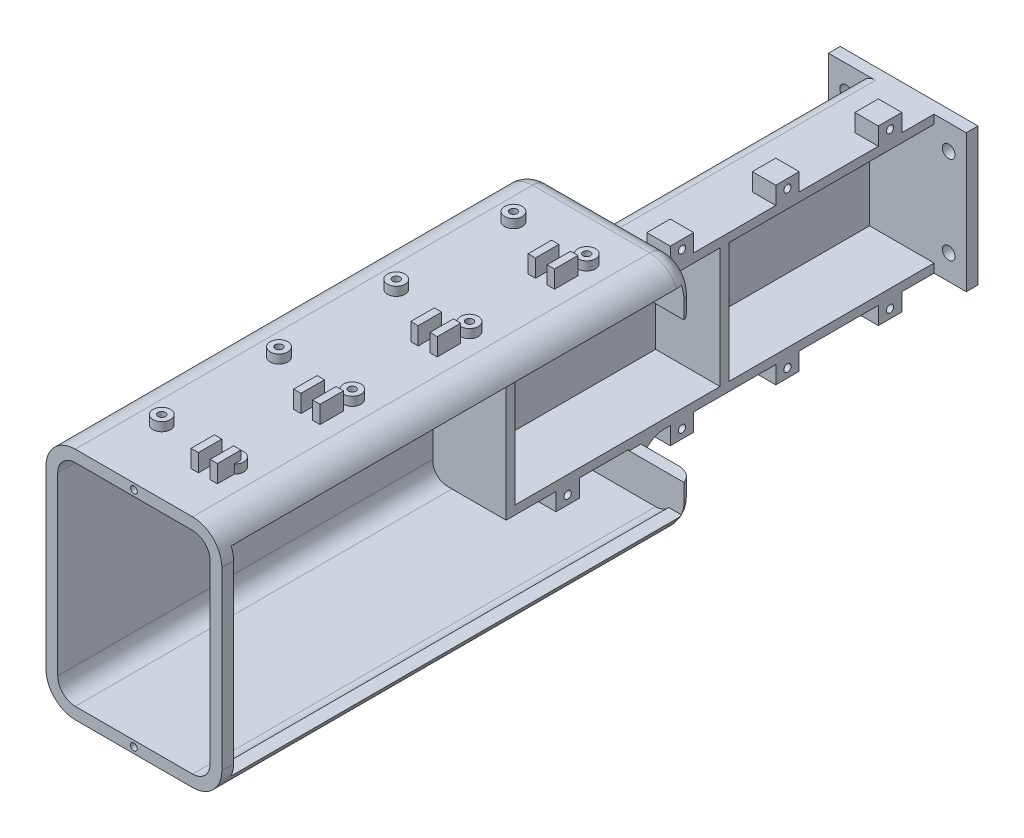
from build123d import *

# Parameters (mm, degrees)
EXTRUDE_1_DEPTH     = 150
FILLET_1_R          = 5
SKETCH_2_W          = 47
SKETCH_2_H          = 47
SKETCH_2_R          = 2.15
EXTRUDE_2_DEPTH     = 4
EXTRUDE_START       = 74
SKETCH_3_W          = 22.5
SKETCH_3_H          = 42
EXTRUDE_3_DEPTH     = 3
EXTRUDE_START_2     = 147
SKETCH_4_W          = 22.5
SKETCH_4_H          = 42
EXTRUDE_4_DEPTH     = 3
EXTRUDE_START_3     = 104
EXTRUDE_5_DEPTH     = 4
EXTRUDE_START_4     = 108
EXTRUDE_6_DEPTH     = 158
FILLET_2_R          = 8
FILLET_3_R          = 6
CUT_EXTRUDE_START   = 77
SKETCH_7_W          = 46
SKETCH_7_H          = 41
CUT_EXTRUDE_1_DEPTH = 70
CUT_EXTRUDE_START_2 = 103
SKETCH_8_W          = 24
SKETCH_8_H          = 48
CUT_EXTRUDE_2_DEPTH = 5.5
CUT_EXTRUDE_START_3 = 108
SKETCH_9_W          = 11
SKETCH_9_H          = 68
CUT_EXTRUDE_3_DEPTH = 154
CUT_EXTRUDE_START_4 = 258
SKETCH_10_R         = 1.15
CUT_EXTRUDE_4_DEPTH = 8
EXTRUDE_START_5     = 40
SKETCH_11_R         = 3
SKETCH_11_R_2       = 1.25
EXTRUDE_7_DEPTH     = 3
EXTRUDE_START_6     = -43
SKETCH_12_R         = 3
SKETCH_12_R_2       = 1.25
EXTRUDE_8_DEPTH     = 3
EXTRUDE_START_7     = -30
SKETCH_13_R         = 3
SKETCH_13_R_2       = 1.25
EXTRUDE_9_DEPTH     = 3
EXTRUDE_START_8     = 3
SKETCH_14_W         = 8
SKETCH_14_H         = 6.5
SKETCH_14_R         = 1.25
EXTRUDE_10_DEPTH    = 8
SKETCH_15_W         = 2.5
SKETCH_15_H         = 8
EXTRUDE_11_DEPTH    = 6
EXTRUDE_START_9     = -40
SKETCH_16_W         = 2.5
SKETCH_16_H         = 8
EXTRUDE_12_DEPTH    = 6


with BuildPart() as part:
    # 草圖1 → 填料-伸長1 (new body)
    with BuildSketch(Plane.XY):
        Polygon((-14, -23.5), (11, -23.5), (11, -20.5), (-11, -20.5), (-11, 20.5), (11, 20.5), (11, 23.5), (-14, 23.5), align=None)
    extrude(amount=EXTRUDE_1_DEPTH)

    # 圓角1
    fillet_1_edges = [part.edges().sort_by_distance(p)[0] for p in [
        (-14, 23.5, 75),
        (-14, -23.5, 75),
    ]]
    fillet(fillet_1_edges, radius=FILLET_1_R)

    # 草圖2 → 填料-伸長2 (add)
    with BuildSketch(Plane.XY):
        with Locations((-1.5, 0)):
            Rectangle(SKETCH_2_W, SKETCH_2_H)
        with Locations((-19, 15)):
            Circle(SKETCH_2_R, mode=Mode.SUBTRACT)
        with Locations((-19, -15)):
            Circle(SKETCH_2_R, mode=Mode.SUBTRACT)
        with Locations((16, 15)):
            Circle(SKETCH_2_R, mode=Mode.SUBTRACT)
        with Locations((16, -15)):
            Circle(SKETCH_2_R, mode=Mode.SUBTRACT)
    extrude(amount=EXTRUDE_2_DEPTH)

    # 草圖3 → 填料-伸長3 (add)
    with BuildSketch(Plane.XY.offset(EXTRUDE_START)):
        with Locations((-0.25, 0)):
            Rectangle(SKETCH_3_W, SKETCH_3_H)
    extrude(amount=EXTRUDE_3_DEPTH)

    # 草圖4 → 填料-伸長4 (add)
    with BuildSketch(Plane.XY.offset(EXTRUDE_START_2)):
        with Locations((-0.25, 0)):
            Rectangle(SKETCH_4_W, SKETCH_4_H)
    extrude(amount=EXTRUDE_4_DEPTH)

    # 草圖5 → 填料-伸長5 (add)
    with BuildSketch(Plane.XY.offset(EXTRUDE_START_3)):
        with BuildLine():
            Line((30, -30), (30, 30))
            ThreePointArc((30, 30), (27.071067812, 37.071067812), (20, 40))
            Line((20, 40), (-20, 40))
            ThreePointArc((-20, 40), (-27.071067812, 37.071067812), (-30, 30))
            Line((-30, 30), (-30, -30))
            ThreePointArc((-30, -30), (-27.071067812, -37.071067812), (-20, -40))
            Line((-20, -40), (20, -40))
            ThreePointArc((20, -40), (27.071067812, -37.071067812), (30, -30))
        make_face()
    extrude(amount=EXTRUDE_5_DEPTH)

    # 草圖6 → 填料-伸長6 (add)
    with BuildSketch(Plane.XY.offset(EXTRUDE_START_4)):
        with BuildLine():
            Line((30, -30), (30, 30))
            ThreePointArc((30, 30), (27.071067812, 37.071067812), (20, 40))
            Line((20, 40), (-20, 40))
            ThreePointArc((-20, 40), (-27.071067812, 37.071067812), (-30, 30))
            Line((-30, 30), (-30, -30))
            ThreePointArc((-30, -30), (-27.071067812, -37.071067812), (-20, -40))
            Line((-20, -40), (20, -40))
            ThreePointArc((20, -40), (27.071067812, -37.071067812), (30, -30))
        make_face()
        with BuildLine():
            Line((26, -30), (26, 30))
            ThreePointArc((26, 30), (24.242640687, 34.242640687), (20, 36))
            Line((20, 36), (-20, 36))
            ThreePointArc((-20, 36), (-24.242640687, 34.242640687), (-26, 30))
            Line((-26, 30), (-26, -30))
            ThreePointArc((-26, -30), (-24.242640687, -34.242640687), (-20, -36))
            Line((-20, -36), (20, -36))
            ThreePointArc((20, -36), (24.242640687, -34.242640687), (26, -30))
        make_face(mode=Mode.SUBTRACT)
    extrude(amount=EXTRUDE_6_DEPTH)

    # 圓角2
    fillet_2_edges = [part.edges().sort_by_distance(p)[0] for p in [
        (-12.535533906, -22.035533906, 104),
        (1, 23.5, 104),
        (-14, 0, 104),
        (1, -23.5, 104),
        (-12.535533906, 22.035533906, 104),
    ]]
    fillet(fillet_2_edges, radius=FILLET_2_R)

    # 圓角3
    fillet_3_edges = [part.edges().sort_by_distance(p)[0] for p in [
        (27.071067812, -37.071067812, 104),
        (30, 0, 104),
        (27.071067812, 37.071067812, 104),
        (0, 40, 104),
        (-27.071067812, 37.071067812, 104),
        (-30, 0, 104),
        (-27.071067812, -37.071067812, 104),
        (0, -40, 104),
    ]]
    fillet(fillet_3_edges, radius=FILLET_3_R)

    # 草圖7 → 除料-伸長1 (cut)
    with BuildSketch(Plane.XY.offset(CUT_EXTRUDE_START)):
        with Locations((12, 0)):
            Rectangle(SKETCH_7_W, SKETCH_7_H)
    extrude(amount=CUT_EXTRUDE_1_DEPTH, mode=Mode.SUBTRACT)

    # 草圖8 → 除料-伸長2 (cut)
    with BuildSketch(Plane.XY.offset(CUT_EXTRUDE_START_2)):
        with Locations((23, 0)):
            Rectangle(SKETCH_8_W, SKETCH_8_H)
    extrude(amount=CUT_EXTRUDE_2_DEPTH, mode=Mode.SUBTRACT)

    # 草圖9 → 除料-伸長3 (cut)
    with BuildSketch(Plane.XY.offset(CUT_EXTRUDE_START_3)):
        with Locations((29.5, 0)):
            Rectangle(SKETCH_9_W, SKETCH_9_H)
    extrude(amount=CUT_EXTRUDE_3_DEPTH, mode=Mode.SUBTRACT)

    # 草圖10 → 除料-伸長4 (cut)
    with BuildSketch(Plane.XY.offset(CUT_EXTRUDE_START_4)):
        with Locations((0, 38)):
            Circle(SKETCH_10_R)
        with Locations((0, -38)):
            Circle(SKETCH_10_R)
    extrude(amount=CUT_EXTRUDE_4_DEPTH, mode=Mode.SUBTRACT)

    # 草圖11 → 填料-伸長7 (add)
    # profile 1 of 8: a face of its own
    with BuildSketch(Plane(origin=(0, 0, 0), x_dir=(1, 0, 0), z_dir=(0, 1, 0)).offset(EXTRUDE_START_5)):
        with Locations(Location((-12.5, -124, 0), (0, 0, 90))):
            Circle(SKETCH_11_R)
        with Locations(Location((-12.5, -124, 0), (0, 0, 270))):
            Circle(SKETCH_11_R_2, mode=Mode.SUBTRACT)
    # profile 2 of 8: a face of its own
    with BuildSketch(Plane(origin=(0, 0, 0), x_dir=(1, 0, 0), z_dir=(0, 1, 0)).offset(EXTRUDE_START_5)):
        with Locations(Location((-12.5, -164, 0), (0, 0, 90))):
            Circle(SKETCH_11_R)
        with Locations(Location((-12.5, -164, 0), (0, 0, 270))):
            Circle(SKETCH_11_R_2, mode=Mode.SUBTRACT)
    # profile 3 of 8: a face of its own
    with BuildSketch(Plane(origin=(0, 0, 0), x_dir=(1, 0, 0), z_dir=(0, 1, 0)).offset(EXTRUDE_START_5)):
        with Locations(Location((-12.5, -204, 0), (0, 0, 90))):
            Circle(SKETCH_11_R)
        with Locations(Location((-12.5, -204, 0), (0, 0, 270))):
            Circle(SKETCH_11_R_2, mode=Mode.SUBTRACT)
    # profile 4 of 8: a face of its own
    with BuildSketch(Plane(origin=(0, 0, 0), x_dir=(1, 0, 0), z_dir=(0, 1, 0)).offset(EXTRUDE_START_5)):
        with Locations(Location((-12.5, -244, 0), (0, 0, 90))):
            Circle(SKETCH_11_R)
        with Locations(Location((-12.5, -244, 0), (0, 0, 270))):
            Circle(SKETCH_11_R_2, mode=Mode.SUBTRACT)
    # profile 5 of 8: a face of its own
    with BuildSketch(Plane(origin=(0, 0, 0), x_dir=(1, 0, 0), z_dir=(0, 1, 0)).offset(EXTRUDE_START_5)):
        with Locations(Location((12.5, -124, 0), (0, 0, 90))):
            Circle(SKETCH_11_R)
        with Locations(Location((12.5, -124, 0), (0, 0, 270))):
            Circle(SKETCH_11_R_2, mode=Mode.SUBTRACT)
    # profile 6 of 8: a face of its own
    with BuildSketch(Plane(origin=(0, 0, 0), x_dir=(1, 0, 0), z_dir=(0, 1, 0)).offset(EXTRUDE_START_5)):
        with Locations(Location((12.5, -164, 0), (0, 0, 90))):
            Circle(SKETCH_11_R)
        with Locations(Location((12.5, -164, 0), (0, 0, 270))):
            Circle(SKETCH_11_R_2, mode=Mode.SUBTRACT)
    # profile 7 of 8: a face of its own
    with BuildSketch(Plane(origin=(0, 0, 0), x_dir=(1, 0, 0), z_dir=(0, 1, 0)).offset(EXTRUDE_START_5)):
        with Locations(Location((12.5, -204, 0), (0, 0, 90))):
            Circle(SKETCH_11_R)
        with Locations(Location((12.5, -204, 0), (0, 0, 270))):
            Circle(SKETCH_11_R_2, mode=Mode.SUBTRACT)
    # profile 8 of 8: a face of its own
    with BuildSketch(Plane(origin=(0, 0, 0), x_dir=(1, 0, 0), z_dir=(0, 1, 0)).offset(EXTRUDE_START_5)):
        with Locations(Location((12.5, -244, 0), (0, 0, 90))):
            Circle(SKETCH_11_R)
        with Locations(Location((12.5, -244, 0), (0, 0, 270))):
            Circle(SKETCH_11_R_2, mode=Mode.SUBTRACT)
    extrude(amount=EXTRUDE_7_DEPTH)

    # 草圖12 → 填料-伸長8 (add)
    # profile 1 of 8: a face of its own
    with BuildSketch(Plane(origin=(0, 0, 0), x_dir=(1, 0, 0), z_dir=(0, 1, 0)).offset(EXTRUDE_START_6)):
        with Locations(Location((-12.5, -124, 0), (0, 0, 90))):
            Circle(SKETCH_12_R)
        with Locations(Location((-12.5, -124, 0), (0, 0, 270))):
            Circle(SKETCH_12_R_2, mode=Mode.SUBTRACT)
    # profile 2 of 8: a face of its own
    with BuildSketch(Plane(origin=(0, 0, 0), x_dir=(1, 0, 0), z_dir=(0, 1, 0)).offset(EXTRUDE_START_6)):
        with Locations(Location((-12.5, -164, 0), (0, 0, 90))):
            Circle(SKETCH_12_R)
        with Locations(Location((-12.5, -164, 0), (0, 0, 270))):
            Circle(SKETCH_12_R_2, mode=Mode.SUBTRACT)
    # profile 3 of 8: a face of its own
    with BuildSketch(Plane(origin=(0, 0, 0), x_dir=(1, 0, 0), z_dir=(0, 1, 0)).offset(EXTRUDE_START_6)):
        with Locations(Location((-12.5, -204, 0), (0, 0, 90))):
            Circle(SKETCH_12_R)
        with Locations(Location((-12.5, -204, 0), (0, 0, 270))):
            Circle(SKETCH_12_R_2, mode=Mode.SUBTRACT)
    # profile 4 of 8: a face of its own
    with BuildSketch(Plane(origin=(0, 0, 0), x_dir=(1, 0, 0), z_dir=(0, 1, 0)).offset(EXTRUDE_START_6)):
        with Locations(Location((-12.5, -244, 0), (0, 0, 90))):
            Circle(SKETCH_12_R)
        with Locations(Location((-12.5, -244, 0), (0, 0, 270))):
            Circle(SKETCH_12_R_2, mode=Mode.SUBTRACT)
    # profile 5 of 8: a face of its own
    with BuildSketch(Plane(origin=(0, 0, 0), x_dir=(1, 0, 0), z_dir=(0, 1, 0)).offset(EXTRUDE_START_6)):
        with Locations(Location((12.5, -124, 0), (0, 0, 90))):
            Circle(SKETCH_12_R)
        with Locations(Location((12.5, -124, 0), (0, 0, 270))):
            Circle(SKETCH_12_R_2, mode=Mode.SUBTRACT)
    # profile 6 of 8: a face of its own
    with BuildSketch(Plane(origin=(0, 0, 0), x_dir=(1, 0, 0), z_dir=(0, 1, 0)).offset(EXTRUDE_START_6)):
        with Locations(Location((12.5, -164, 0), (0, 0, 90))):
            Circle(SKETCH_12_R)
        with Locations(Location((12.5, -164, 0), (0, 0, 270))):
            Circle(SKETCH_12_R_2, mode=Mode.SUBTRACT)
    # profile 7 of 8: a face of its own
    with BuildSketch(Plane(origin=(0, 0, 0), x_dir=(1, 0, 0), z_dir=(0, 1, 0)).offset(EXTRUDE_START_6)):
        with Locations(Location((12.5, -204, 0), (0, 0, 90))):
            Circle(SKETCH_12_R)
        with Locations(Location((12.5, -204, 0), (0, 0, 270))):
            Circle(SKETCH_12_R_2, mode=Mode.SUBTRACT)
    # profile 8 of 8: a face of its own
    with BuildSketch(Plane(origin=(0, 0, 0), x_dir=(1, 0, 0), z_dir=(0, 1, 0)).offset(EXTRUDE_START_6)):
        with Locations(Location((12.5, -244, 0), (0, 0, 90))):
            Circle(SKETCH_12_R)
        with Locations(Location((12.5, -244, 0), (0, 0, 270))):
            Circle(SKETCH_12_R_2, mode=Mode.SUBTRACT)
    extrude(amount=EXTRUDE_8_DEPTH)

    # 草圖13 → 填料-伸長9 (add)
    # profile 1 of 8: a face of its own
    with BuildSketch(Plane(origin=(0, 0, 0), x_dir=(0, 0, -1), z_dir=(1, 0, 0)).offset(EXTRUDE_START_7)):
        with Locations((-124, -15)):
            Circle(SKETCH_13_R)
        with Locations((-124, -15)):
            Circle(SKETCH_13_R_2, mode=Mode.SUBTRACT)
    # profile 2 of 8: a face of its own
    with BuildSketch(Plane(origin=(0, 0, 0), x_dir=(0, 0, -1), z_dir=(1, 0, 0)).offset(EXTRUDE_START_7)):
        with Locations((-164, -15)):
            Circle(SKETCH_13_R)
        with Locations((-164, -15)):
            Circle(SKETCH_13_R_2, mode=Mode.SUBTRACT)
    # profile 3 of 8: a face of its own
    with BuildSketch(Plane(origin=(0, 0, 0), x_dir=(0, 0, -1), z_dir=(1, 0, 0)).offset(EXTRUDE_START_7)):
        with Locations((-204, -15)):
            Circle(SKETCH_13_R)
        with Locations((-204, -15)):
            Circle(SKETCH_13_R_2, mode=Mode.SUBTRACT)
    # profile 4 of 8: a face of its own
    with BuildSketch(Plane(origin=(0, 0, 0), x_dir=(0, 0, -1), z_dir=(1, 0, 0)).offset(EXTRUDE_START_7)):
        with Locations((-244, -15)):
            Circle(SKETCH_13_R)
        with Locations((-244, -15)):
            Circle(SKETCH_13_R_2, mode=Mode.SUBTRACT)
    # profile 5 of 8: a face of its own
    with BuildSketch(Plane(origin=(0, 0, 0), x_dir=(0, 0, -1), z_dir=(1, 0, 0)).offset(EXTRUDE_START_7)):
        with Locations((-124, 15)):
            Circle(SKETCH_13_R)
        with Locations((-124, 15)):
            Circle(SKETCH_13_R_2, mode=Mode.SUBTRACT)
    # profile 6 of 8: a face of its own
    with BuildSketch(Plane(origin=(0, 0, 0), x_dir=(0, 0, -1), z_dir=(1, 0, 0)).offset(EXTRUDE_START_7)):
        with Locations((-164, 15)):
            Circle(SKETCH_13_R)
        with Locations((-164, 15)):
            Circle(SKETCH_13_R_2, mode=Mode.SUBTRACT)
    # profile 7 of 8: a face of its own
    with BuildSketch(Plane(origin=(0, 0, 0), x_dir=(0, 0, -1), z_dir=(1, 0, 0)).offset(EXTRUDE_START_7)):
        with Locations((-204, 15)):
            Circle(SKETCH_13_R)
        with Locations((-204, 15)):
            Circle(SKETCH_13_R_2, mode=Mode.SUBTRACT)
    # profile 8 of 8: a face of its own
    with BuildSketch(Plane(origin=(0, 0, 0), x_dir=(0, 0, -1), z_dir=(1, 0, 0)).offset(EXTRUDE_START_7)):
        with Locations((-244, 15)):
            Circle(SKETCH_13_R)
        with Locations((-244, 15)):
            Circle(SKETCH_13_R_2, mode=Mode.SUBTRACT)
    extrude(amount=-EXTRUDE_9_DEPTH)

    # 草圖14 → 填料-伸長10 (add)
    # profile 1 of 8: a face of its own
    with BuildSketch(Plane(origin=(0, 0, 0), x_dir=(0, 0, -1), z_dir=(1, 0, 0)).offset(EXTRUDE_START_8)):
        with Locations((-19, 26.25)):
            Rectangle(SKETCH_14_W, SKETCH_14_H)
        with Locations((-19, 26.5)):
            Circle(SKETCH_14_R, mode=Mode.SUBTRACT)
    # profile 2 of 8: a face of its own
    with BuildSketch(Plane(origin=(0, 0, 0), x_dir=(0, 0, -1), z_dir=(1, 0, 0)).offset(EXTRUDE_START_8)):
        with Locations((-19, -26.25)):
            Rectangle(SKETCH_14_W, SKETCH_14_H)
        with Locations((-19, -26.5)):
            Circle(SKETCH_14_R, mode=Mode.SUBTRACT)
    # profile 3 of 8: a face of its own
    with BuildSketch(Plane(origin=(0, 0, 0), x_dir=(0, 0, -1), z_dir=(1, 0, 0)).offset(EXTRUDE_START_8)):
        with Locations((-54, 26.25)):
            Rectangle(SKETCH_14_W, SKETCH_14_H)
        with Locations((-54, 26.5)):
            Circle(SKETCH_14_R, mode=Mode.SUBTRACT)
    # profile 4 of 8: a face of its own
    with BuildSketch(Plane(origin=(0, 0, 0), x_dir=(0, 0, -1), z_dir=(1, 0, 0)).offset(EXTRUDE_START_8)):
        with Locations((-54, -26.25)):
            Rectangle(SKETCH_14_W, SKETCH_14_H)
        with Locations((-54, -26.5)):
            Circle(SKETCH_14_R, mode=Mode.SUBTRACT)
    # profile 5 of 8: a face of its own
    with BuildSketch(Plane(origin=(0, 0, 0), x_dir=(0, 0, -1), z_dir=(1, 0, 0)).offset(EXTRUDE_START_8)):
        with Locations((-90, 26.25)):
            Rectangle(SKETCH_14_W, SKETCH_14_H)
        with Locations((-90, 26.5)):
            Circle(SKETCH_14_R, mode=Mode.SUBTRACT)
    # profile 6 of 8: a face of its own
    with BuildSketch(Plane(origin=(0, 0, 0), x_dir=(0, 0, -1), z_dir=(1, 0, 0)).offset(EXTRUDE_START_8)):
        with Locations((-90, -26.25)):
            Rectangle(SKETCH_14_W, SKETCH_14_H)
        with Locations((-90, -26.5)):
            Circle(SKETCH_14_R, mode=Mode.SUBTRACT)
    # profile 7 of 8: a face of its own
    with BuildSketch(Plane(origin=(0, 0, 0), x_dir=(0, 0, -1), z_dir=(1, 0, 0)).offset(EXTRUDE_START_8)):
        with Locations((-129, 26.25)):
            Rectangle(SKETCH_14_W, SKETCH_14_H)
        with Locations((-129, 26.5)):
            Circle(SKETCH_14_R, mode=Mode.SUBTRACT)
    # profile 8 of 8: a face of its own
    with BuildSketch(Plane(origin=(0, 0, 0), x_dir=(0, 0, -1), z_dir=(1, 0, 0)).offset(EXTRUDE_START_8)):
        with Locations((-129, -26.25)):
            Rectangle(SKETCH_14_W, SKETCH_14_H)
        with Locations((-129, -26.5)):
            Circle(SKETCH_14_R, mode=Mode.SUBTRACT)
    extrude(amount=EXTRUDE_10_DEPTH)

    # 草圖15 → 填料-伸長11 (add)
    with BuildSketch(Plane(origin=(0, 0, 0), x_dir=(1, 0, 0), z_dir=(0, 1, 0)).offset(EXTRUDE_START_5)):
        with Locations((6.75, -133)):
            Rectangle(SKETCH_15_W, SKETCH_15_H)
        with Locations((13.25, -133)):
            Rectangle(SKETCH_15_W, SKETCH_15_H)
        with Locations((6.75, -173)):
            Rectangle(SKETCH_15_W, SKETCH_15_H)
        with Locations((13.25, -173)):
            Rectangle(SKETCH_15_W, SKETCH_15_H)
        with Locations((6.75, -213)):
            Rectangle(SKETCH_15_W, SKETCH_15_H)
        with Locations((13.25, -213)):
            Rectangle(SKETCH_15_W, SKETCH_15_H)
        with Locations((6.75, -248)):
            Rectangle(SKETCH_15_W, SKETCH_15_H)
        with Locations((13.25, -248)):
            Rectangle(SKETCH_15_W, SKETCH_15_H)
    extrude(amount=EXTRUDE_11_DEPTH)

    # 草圖16 → 填料-伸長12 (add)
    with BuildSketch(Plane(origin=(0, 0, 0), x_dir=(1, 0, 0), z_dir=(0, 1, 0)).offset(EXTRUDE_START_9)):
        with Locations((6.75, -133)):
            Rectangle(SKETCH_16_W, SKETCH_16_H)
        with Locations((13.25, -133)):
            Rectangle(SKETCH_16_W, SKETCH_16_H)
        with Locations((6.75, -173)):
            Rectangle(SKETCH_16_W, SKETCH_16_H)
        with Locations((13.25, -173)):
            Rectangle(SKETCH_16_W, SKETCH_16_H)
        with Locations((6.75, -213)):
            Rectangle(SKETCH_16_W, SKETCH_16_H)
        with Locations((13.25, -213)):
            Rectangle(SKETCH_16_W, SKETCH_16_H)
        with Locations((6.75, -248)):
            Rectangle(SKETCH_16_W, SKETCH_16_H)
        with Locations((13.25, -248)):
            Rectangle(SKETCH_16_W, SKETCH_16_H)
    extrude(amount=-EXTRUDE_12_DEPTH)


solid = part.part
